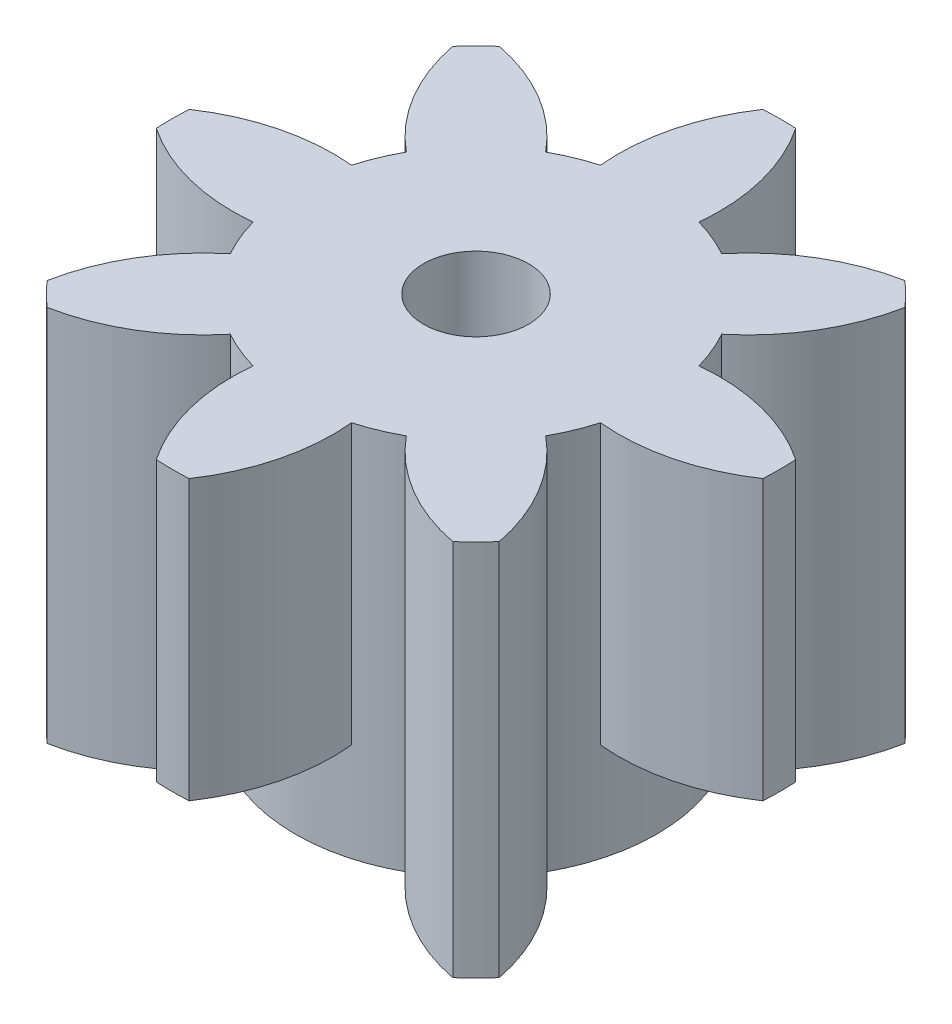
from build123d import *
from build123d.topology import SkipClean

# Parameters (mm, degrees)
BOSS_EXTRUDE1_DEPTH      = 17
BOSS_EXTRUDE1_DEPTH_BACK = 6
SKETCH1_R                = 3.2
CUT_EXTRUDE1_START       = -10
CUT_EXTRUDE1_DEPTH       = 10


with BuildPart() as part:
    # Sketch1 → Boss-Extrude1 (new, two sides: drawn at the far end of the back side and taken through both)
    with BuildSketch(Plane(origin=(0, 0, 0), x_dir=(1, 0, 0), z_dir=(0, 1, 0)).offset(-BOSS_EXTRUDE1_DEPTH_BACK)):
        with BuildLine():
            ThreePointArc((18.472953202, -1), (18.5, 0), (18.472953202, 1))
            ThreePointArc((18.472953202, 1), (14.702730308, 2.689388484), (10.583005244, 3))
            ThreePointArc((10.583005244, 3), (10.162674858, 4.209517756), (9.604635117, 5.36199443))
            ThreePointArc((9.604635117, 5.36199443), (12.298085137, 8.494715469), (13.769457259, 12.355243696))
            ThreePointArc((13.769457259, 12.355243696), (13.081475452, 13.081475452), (12.355243696, 13.769457259))
            ThreePointArc((12.355243696, 13.769457259), (8.494715469, 12.298085137), (5.36199443, 9.604635117))
            ThreePointArc((5.36199443, 9.604635117), (4.209517756, 10.162674858), (3, 10.583005244))
            ThreePointArc((3, 10.583005244), (2.689388484, 14.702730308), (1, 18.472953202))
            ThreePointArc((1, 18.472953202), (0, 18.5), (-1, 18.472953202))
            ThreePointArc((-1, 18.472953202), (-2.689388484, 14.702730308), (-3, 10.583005244))
            ThreePointArc((-3, 10.583005244), (-4.209517756, 10.162674858), (-5.36199443, 9.604635117))
            ThreePointArc((-5.36199443, 9.604635117), (-8.494715469, 12.298085137), (-12.355243696, 13.769457259))
            ThreePointArc((-12.355243696, 13.769457259), (-13.081475452, 13.081475452), (-13.769457259, 12.355243696))
            ThreePointArc((-13.769457259, 12.355243696), (-12.298085137, 8.494715469), (-9.604635117, 5.36199443))
            ThreePointArc((-9.604635117, 5.36199443), (-10.162674858, 4.209517756), (-10.583005244, 3))
            ThreePointArc((-10.583005244, 3), (-14.702730308, 2.689388484), (-18.472953202, 1))
            ThreePointArc((-18.472953202, 1), (-18.5, 0), (-18.472953202, -1))
            ThreePointArc((-18.472953202, -1), (-14.702730308, -2.689388484), (-10.583005244, -3))
            ThreePointArc((-10.583005244, -3), (-10.162674858, -4.209517756), (-9.604635117, -5.36199443))
            ThreePointArc((-9.604635117, -5.36199443), (-12.298085137, -8.494715469), (-13.769457259, -12.355243696))
            ThreePointArc((-13.769457259, -12.355243696), (-13.081475452, -13.081475452), (-12.355243696, -13.769457259))
            ThreePointArc((-12.355243696, -13.769457259), (-8.494715469, -12.298085137), (-5.36199443, -9.604635117))
            ThreePointArc((-5.36199443, -9.604635117), (-4.209517756, -10.162674858), (-3, -10.583005244))
            ThreePointArc((-3, -10.583005244), (-2.689388484, -14.702730308), (-1, -18.472953202))
            ThreePointArc((-1, -18.472953202), (0, -18.5), (1, -18.472953202))
            ThreePointArc((1, -18.472953202), (2.689388484, -14.702730308), (3, -10.583005244))
            ThreePointArc((3, -10.583005244), (4.209517756, -10.162674858), (5.36199443, -9.604635117))
            ThreePointArc((5.36199443, -9.604635117), (8.494715469, -12.298085137), (12.355243696, -13.769457259))
            ThreePointArc((12.355243696, -13.769457259), (13.081475452, -13.081475452), (13.769457259, -12.355243696))
            ThreePointArc((13.769457259, -12.355243696), (12.298085137, -8.494715469), (9.604635117, -5.36199443))
            ThreePointArc((9.604635117, -5.36199443), (10.162674858, -4.209517756), (10.583005244, -3))
            ThreePointArc((10.583005244, -3), (14.702730308, -2.689388484), (18.472953202, -1))
        make_face()
        Circle(SKETCH1_R, mode=Mode.SUBTRACT)
    extrude(amount=BOSS_EXTRUDE1_DEPTH + BOSS_EXTRUDE1_DEPTH_BACK)

    # Sketch1<7> → Cut-Extrude1 (cut)
    with SkipClean():  # the faces are left unmerged after this step: merging them gives an invalid solid
        with BuildSketch(Plane(origin=(0, 0, 0), x_dir=(1, 0, 0), z_dir=(0, 1, 0)).offset(CUT_EXTRUDE1_START)):
            with BuildLine():
                ThreePointArc((18.472953202, -1), (18.5, 0), (18.472953202, 1))
                ThreePointArc((18.472953202, 1), (14.702730308, 2.689388484), (10.583005244, 3))
                ThreePointArc((10.583005244, 3), (11, 0), (10.583005244, -3))
                ThreePointArc((10.583005244, -3), (14.702730308, -2.689388484), (18.472953202, -1))
            make_face()
            with BuildLine():
                ThreePointArc((3, 10.583005244), (2.689388484, 14.702730308), (1, 18.472953202))
                ThreePointArc((1, 18.472953202), (0, 18.5), (-1, 18.472953202))
                ThreePointArc((-1, 18.472953202), (-2.689388484, 14.702730308), (-3, 10.583005244))
                ThreePointArc((-3, 10.583005244), (0, 11), (3, 10.583005244))
            make_face()
            with BuildLine():
                ThreePointArc((-1, -18.472953202), (0, -18.5), (1, -18.472953202))
                ThreePointArc((1, -18.472953202), (2.689388484, -14.702730308), (3, -10.583005244))
                ThreePointArc((3, -10.583005244), (0, -11), (-3, -10.583005244))
                ThreePointArc((-3, -10.583005244), (-2.689388484, -14.702730308), (-1, -18.472953202))
            make_face()
            with BuildLine():
                ThreePointArc((-10.583005244, 3), (-14.702730308, 2.689388484), (-18.472953202, 1))
                ThreePointArc((-18.472953202, 1), (-18.5, 0), (-18.472953202, -1))
                ThreePointArc((-18.472953202, -1), (-14.702730308, -2.689388484), (-10.583005244, -3))
                ThreePointArc((-10.583005244, -3), (-11, 0), (-10.583005244, 3))
            make_face()
        extrude(amount=CUT_EXTRUDE1_DEPTH, mode=Mode.SUBTRACT)


solid = part.part
